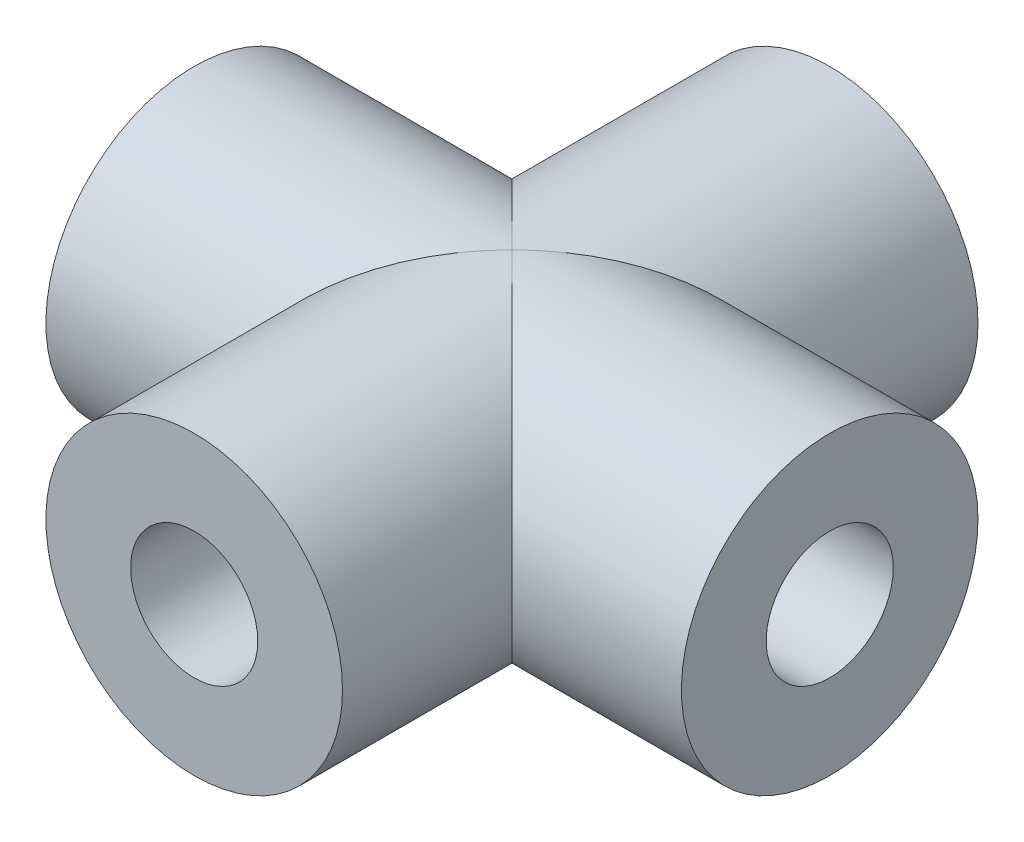
from build123d import *

# Parameters (mm, degrees)
SKETCH1_R           = 7
BOSS_EXTRUDE1_DEPTH = 15
SKETCH4_R           = 7
BOSS_EXTRUDE2_DEPTH = 15
SKETCH3_R           = 3
CUT_EXTRUDE1_DEPTH  = 5.625
CIRPATTERN1_COUNT   = 4


with BuildPart() as part:
    # Sketch1 → Boss-Extrude1 (new, symmetric)
    with BuildSketch(Plane.XY):
        Circle(SKETCH1_R)
    extrude(amount=BOSS_EXTRUDE1_DEPTH, both=True)

    # Sketch4 → Boss-Extrude2 (add, symmetric)
    with BuildSketch(Plane(origin=(0, 0, 0), x_dir=(0, 0, -1), z_dir=(1, 0, 0))):
        with Locations(Location((0, 0, 0), (0, 0, 270))):
            Circle(SKETCH4_R)
    extrude(amount=BOSS_EXTRUDE2_DEPTH, both=True)

    # Sketch3 → Cut-Extrude1 (cut)
    with BuildSketch(Plane.XY.offset(15)):
        Circle(SKETCH3_R)
    cut_extrude1 = extrude(amount=-CUT_EXTRUDE1_DEPTH, mode=Mode.SUBTRACT)

    # CirPattern1: Cut-Extrude1 ×4 about axis
    cirpattern1_axis = Axis((0, 0, 0), (0, 1, 0))
    for i in range(1, CIRPATTERN1_COUNT):
        add(cut_extrude1.rotate(cirpattern1_axis, i * 360 / CIRPATTERN1_COUNT), mode=Mode.SUBTRACT)


solid = part.part
